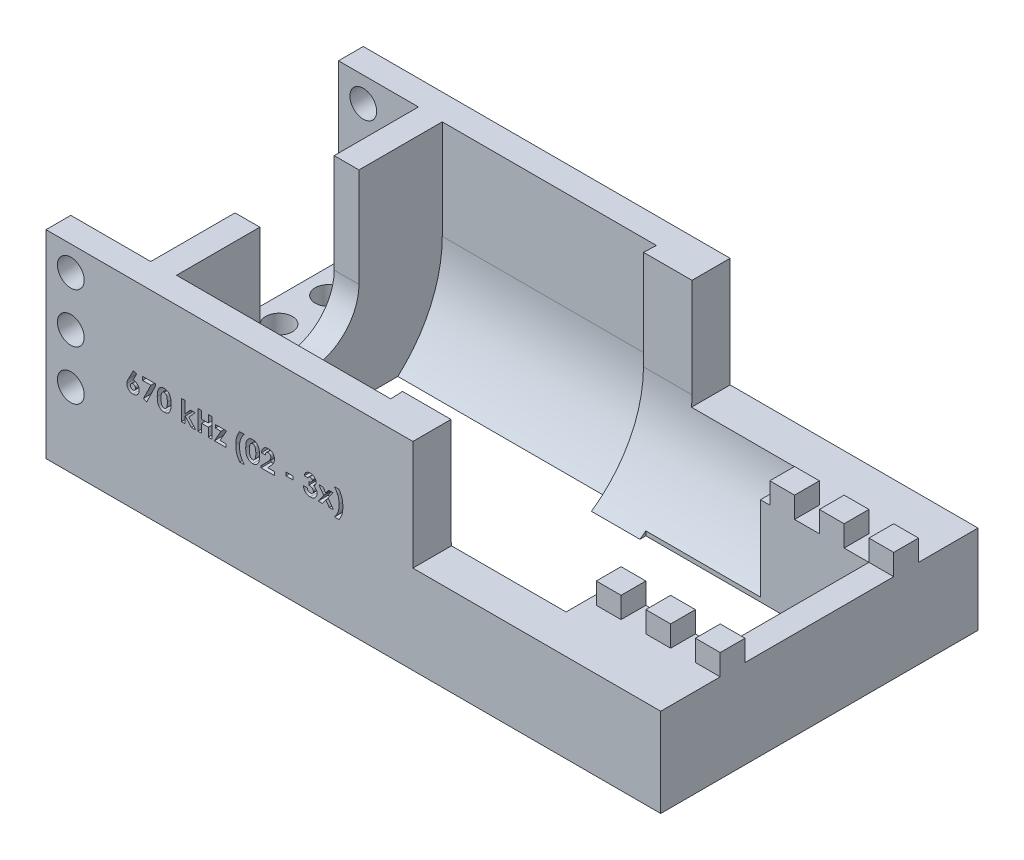
from build123d import *

# Parameters (mm, degrees)
SKETCH1_W                = 157.48
SKETCH1_H                = 50.8
BOSS_EXTRUDE1_DEPTH      = 40.64
SKETCH37_W               = 81.28
SKETCH37_H               = 25.4
CUT_EXTRUDE32_DEPTH      = 171.388379885
BOSS_EXTRUDE5_DEPTH      = 25.4
CUT_EXTRUDE54_DEPTH      = 105.109019782
CUT_EXTRUDE54_DEPTH_BACK = 105.109019782
SKETCH45_W               = 63.5
SKETCH45_H               = 28.09875
SKETCH97_W               = 20.4891
SKETCH97_H               = 81.28
CUT_EXTRUDE72_DEPTH      = 44.45
SKETCH98_R               = 3.429
CUT_EXTRUDE73_DEPTH      = 102.162495521
SKETCH99_W               = 57.15
SKETCH99_H               = 38.1
CUT_EXTRUDE74_DEPTH      = 105.109019782
SKETCH101_W              = 6.35
SKETCH101_H              = 6.35
BOSS_EXTRUDE7_DEPTH      = 5.3975
BOSS_EXTRUDE8_REACH      = 106.109
SKETCH102_W              = 20.4891
SKETCH102_H              = 6.35
SKETCH103_R              = 3.429
CUT_EXTRUDE75_DEPTH      = 126.672259469
CUT_EXTRUDE76_DEPTH      = 2.54


with BuildPart() as part:
    # Sketch1 → Boss-Extrude1 (new, symmetric)
    with BuildSketch(Plane.XY):
        with Locations((2.54, -25.4)):
            Rectangle(SKETCH1_W, SKETCH1_H)
    extrude(amount=BOSS_EXTRUDE1_DEPTH, both=True)

    # Sketch2 → Cut-Revolve1 (revolve, cut)
    with BuildSketch(Plane.XY, mode=Mode.PRIVATE) as cut_revolve1_sk:
        Polygon((-49.3609, 8.636), (-49.3609, -12.7), (-76.2, -12.7), (-76.2, -25.4), (19.629439755, -25.4), (72.533481331, -25.4), (72.533481331, -15.494), (47.133481331, -15.494), (47.133481331, 5.464285578), (5.358695608, 5.464285578), (5.5031, 8.636), align=None)
    revolve(cut_revolve1_sk.sketch.rotate(Axis((-607.361866059, -25.4, 0), (1, 0, 0)), 90), axis=Axis((-607.361866059, -25.4, 0), (1, 0, 0)), mode=Mode.SUBTRACT)

    # Sketch37 → Cut-Extrude32 (cut, through all)
    with BuildSketch(Plane(origin=(81.28, 0, 0), x_dir=(0, 0, -1), z_dir=(1, 0, 0))):
        with Locations((0, -12.7)):
            Rectangle(SKETCH37_W, SKETCH37_H)
    extrude(amount=-CUT_EXTRUDE32_DEPTH, mode=Mode.SUBTRACT)

    # Sketch39 → Boss-Extrude5 (add)
    with BuildSketch(Plane(origin=(0, -25.4, 0), x_dir=(1, 0, 0), z_dir=(0, 1, 0))):
        Polygon((-49.3609, -12.7), (-76.2, -12.7), (-76.2, -40.64), (81.28, -40.64), (81.28, 40.64), (-76.2, 40.64), (-76.2, 12.7), (-49.3609, 12.7), (-49.3609, 34.036), (5.5031, 34.036), (5.358695608, 30.864285578), (47.133481331, 30.864285578), (47.133481331, 9.906), (72.533481331, 9.906), (72.533481331, -9.906), (47.133481331, -9.906), (47.133481331, -30.864285578), (5.358695608, -30.864285578), (5.5031, -34.036), (-49.3609, -34.036), align=None)
    extrude(amount=BOSS_EXTRUDE5_DEPTH)

    # Sketch45 → Cut-Extrude54 (cut, two sides: drawn at the far end of the back side and taken through both)
    with BuildSketch(Plane.XY.offset(-CUT_EXTRUDE54_DEPTH_BACK)):
        with Locations((49.53, -14.049375)):
            Rectangle(SKETCH45_W, SKETCH45_H)
    extrude(amount=CUT_EXTRUDE54_DEPTH + CUT_EXTRUDE54_DEPTH_BACK, mode=Mode.SUBTRACT)

    # Sketch97 → Cut-Extrude72 (cut)
    with BuildSketch(Plane(origin=(0, 0, 0), x_dir=(1, 0, 0), z_dir=(0, 1, 0))):
        with Locations((-65.95545, 0)):
            Rectangle(SKETCH97_W, SKETCH97_H)
    extrude(amount=-CUT_EXTRUDE72_DEPTH, mode=Mode.SUBTRACT)

    # Sketch98 → Cut-Extrude73 (cut, through all)
    with BuildSketch(Plane(origin=(0, -44.45, 0), x_dir=(1, 0, 0), z_dir=(0, 1, 0))):
        with Locations(Location((-69.85, 25.4, 0), (0, 0, 270))):
            Circle(SKETCH98_R)
        with Locations(Location((-69.85, 12.7, 0), (0, 0, 270))):
            Circle(SKETCH98_R)
        with Locations(Location((-69.85, 0, 0), (0, 0, 270))):
            Circle(SKETCH98_R)
        with Locations(Location((-69.85, -12.7, 0), (0, 0, 270))):
            Circle(SKETCH98_R)
        with Locations(Location((-69.85, -25.4, 0), (0, 0, 270))):
            Circle(SKETCH98_R)
    extrude(amount=-CUT_EXTRUDE73_DEPTH, mode=Mode.SUBTRACT)

    # Sketch99 → Cut-Extrude74 (cut, through all)
    with BuildSketch(Plane(origin=(0, 0, 0), x_dir=(1, 0, 0), z_dir=(0, 1, 0))):
        with Locations((46.355, 0)):
            Rectangle(SKETCH99_W, SKETCH99_H)
    extrude(amount=-CUT_EXTRUDE74_DEPTH, mode=Mode.SUBTRACT)

    # Sketch101 → Boss-Extrude7 (add)
    with BuildSketch(Plane(origin=(0, -28.09875, 0), x_dir=(1, 0, 0), z_dir=(0, 1, 0))):
        with Locations((52.705, 22.225)):
            Rectangle(SKETCH101_W, SKETCH101_H)
        with Locations((65.405, 22.225)):
            Rectangle(SKETCH101_W, SKETCH101_H)
        with Locations((78.105, 22.225)):
            Rectangle(SKETCH101_W, SKETCH101_H)
        with Locations((78.105, -22.225)):
            Rectangle(SKETCH101_W, SKETCH101_H)
        with Locations((65.405, -22.225)):
            Rectangle(SKETCH101_W, SKETCH101_H)
        with Locations((52.705, -22.225)):
            Rectangle(SKETCH101_W, SKETCH101_H)
    extrude(amount=BOSS_EXTRUDE7_DEPTH)

    # Sketch102 → Boss-Extrude8 (add, up to next)
    with BuildSketch(Plane(origin=(0, 0, 0), x_dir=(1, 0, 0), z_dir=(0, 1, 0)), mode=Mode.PRIVATE) as boss_extrude8_sk1:
        with Locations((-65.95545, 37.465)):
            Rectangle(SKETCH102_W, SKETCH102_H)
    boss_extrude8_tool1 = extrude(boss_extrude8_sk1.sketch, amount=-BOSS_EXTRUDE8_REACH, mode=Mode.PRIVATE) - part.part
    # Sketch102 → Boss-Extrude8 (add, up to next)
    with BuildSketch(Plane(origin=(0, 0, 0), x_dir=(1, 0, 0), z_dir=(0, 1, 0)), mode=Mode.PRIVATE) as boss_extrude8_sk2:
        with Locations((-65.95545, -37.465)):
            Rectangle(SKETCH102_W, SKETCH102_H)
    boss_extrude8_tool2 = extrude(boss_extrude8_sk2.sketch, amount=-BOSS_EXTRUDE8_REACH, mode=Mode.PRIVATE) - part.part
    add(boss_extrude8_tool1.solids().sort_by_distance((-65.95545, 0, -37.465))[0])
    add(boss_extrude8_tool2.solids().sort_by_distance((-65.95545, 0, 37.465))[0])

    # Sketch103 → Cut-Extrude75 (cut, through all)
    with BuildSketch(Plane.XY.offset(40.64)):
        with Locations((-69.85, -6.35)):
            Circle(SKETCH103_R)
        with Locations((-69.85, -19.05)):
            Circle(SKETCH103_R)
        with Locations((-69.85, -31.75)):
            Circle(SKETCH103_R)
    extrude(amount=-CUT_EXTRUDE75_DEPTH, mode=Mode.SUBTRACT)

    # Sketch104 → Cut-Extrude76 (cut)
    # profile 1 of 13: a face of its own
    with BuildSketch(Plane.XY.offset(40.64)):
        with BuildLine():
            Line((-53.797841785, -20.030968002), (-52.981703964, -20.442089797))
            Line((-52.981703964, -20.442089797), (-53.867040503, -22.157810951))
            add(Edge.make_bspline(
                [(-53.867040503, -22.157810951), (-53.814368963, -22.159008106), (-53.710567955, -22.161367368), (-53.558413758, -22.185184077), (-53.41176591, -22.219925848), (-53.271763544, -22.271528946), (-53.137713629, -22.336910544), (-53.00992314, -22.416845793), (-52.888337675, -22.511046892), (-52.774152481, -22.618627316), (-52.669200502, -22.735917579), (-52.57764104, -22.862535194), (-52.500284919, -22.995854037), (-52.436658572, -23.136234839), (-52.387532764, -23.283579989), (-52.353677585, -23.437794908), (-52.330867365, -23.598769622), (-52.329224917, -23.708594399), (-52.328386657, -23.764645887)],
                knots=[0, 0, 0, 0, 1.018436016, 2.007055153, 2.973393371, 3.930660523, 4.887657592, 5.854775734, 6.842086597, 7.859062064, 8.886574234, 9.883115039, 10.877210128, 11.864259127, 12.860583739, 13.876541934, 14.916246501, 16, 16, 16, 16], degree=3))
            add(Edge.make_bspline(
                [(-52.328386657, -23.764645887), (-52.329631405, -23.818659555), (-52.33208508, -23.925132392), (-52.355196241, -24.081270011), (-52.392187401, -24.230656385), (-52.441697369, -24.374860684), (-52.508551703, -24.511691202), (-52.588012639, -24.642977063), (-52.682933792, -24.767069144), (-52.790495599, -24.883280834), (-52.907830611, -24.990216199), (-53.033315519, -25.082717685), (-53.164246753, -25.161935484), (-53.301358368, -25.226361871), (-53.444292079, -25.276301017), (-53.593225029, -25.312094569), (-53.748008122, -25.333898332), (-53.853401502, -25.336554922), (-53.906728003, -25.337899092)],
                knots=[0, 0, 0, 0, 1.04492794, 2.059783157, 3.047058374, 4.02090364, 5.004635914, 5.988762478, 6.986742238, 8.022866921, 9.05013389, 10.054679023, 11.035405115, 12.007566906, 12.981412172, 13.960752762, 14.96819022, 16, 16, 16, 16], degree=3))
            add(Edge.make_bspline(
                [(-53.906728003, -25.337899092), (-53.962436749, -25.336237006), (-54.072269543, -25.332960112), (-54.233090179, -25.310015623), (-54.38754573, -25.27382947), (-54.534022924, -25.220499039), (-54.673476576, -25.152919934), (-54.805729305, -25.070675296), (-54.931417604, -24.974066969), (-55.046718342, -24.862051982), (-55.153378998, -24.742770841), (-55.244432003, -24.615635281), (-55.324485163, -24.486357689), (-55.38707923, -24.350951492), (-55.437791857, -24.211933235), (-55.473346515, -24.068359311), (-55.494040778, -23.92027198), (-55.496867173, -23.820341062), (-55.498298516, -23.769734028)],
                knots=[0, 0, 0, 0, 1.07701802, 2.123399041, 3.135246409, 4.139496384, 5.131070391, 6.126736415, 7.14616676, 8.190015937, 9.230996512, 10.236017373, 11.210212812, 12.166803947, 13.115014964, 14.067955921, 15.02157389, 16, 16, 16, 16], degree=3))
            add(Edge.make_bspline(
                [(-55.498298516, -23.769734028), (-55.497130351, -23.730695245), (-55.494777605, -23.652069098), (-55.481568402, -23.534277736), (-55.458466658, -23.4164924), (-55.433245129, -23.317101349), (-55.406161067, -23.233266124), (-55.379510921, -23.162037797), (-55.346571685, -23.082931101), (-55.309331698, -22.995405827), (-55.265149724, -22.90058475), (-55.215063972, -22.798070535), (-55.160344999, -22.686854181), (-55.120896994, -22.610585473), (-55.100405887, -22.570968002)],
                knots=[0, 0, 0, 0, 1.101224057, 2.217922746, 3.338058447, 4.48432198, 5.107562151, 5.821941898, 6.628510777, 7.524171874, 8.504386177, 9.57834465, 10.742080967, 12, 12, 12, 12], degree=3))
            Line((-55.100405887, -22.570968002), (-53.797841785, -20.030968002))
        make_face()
        with BuildLine():
            add(Edge.make_bspline(
                [(-53.923010054, -23.067570567), (-53.966332107, -23.069877067), (-54.050802568, -23.074374341), (-54.172233, -23.110959704), (-54.280960528, -23.174224964), (-54.377186529, -23.258399817), (-54.456620687, -23.360993678), (-54.514578966, -23.478546317), (-54.550272409, -23.608576984), (-54.554041488, -23.699625965), (-54.555974798, -23.746328579)],
                knots=[0, 0, 0, 0, 1.002982451, 1.955641158, 2.906481193, 3.898338504, 4.901690695, 5.893267499, 6.91937378, 8, 8, 8, 8], degree=3))
            add(Edge.make_bspline(
                [(-54.555974798, -23.746328579), (-54.554178716, -23.793404872), (-54.550686021, -23.88495029), (-54.512979791, -24.0161367), (-54.453708945, -24.136130887), (-54.370957178, -24.240865078), (-54.273713405, -24.328663596), (-54.16389336, -24.391462534), (-54.046199791, -24.431922234), (-53.964378392, -24.43616875), (-53.923010054, -24.438315759)],
                knots=[0, 0, 0, 0, 1.082440894, 2.10493434, 3.118992292, 4.14970393, 5.163309616, 6.119560889, 7.049262895, 8, 8, 8, 8], degree=3))
            add(Edge.make_bspline(
                [(-53.923010054, -24.438315759), (-53.879692478, -24.435963668), (-53.794580097, -24.43134217), (-53.671629449, -24.394729894), (-53.559630232, -24.331613164), (-53.459533617, -24.24622667), (-53.375346045, -24.142298392), (-53.312867513, -24.022850336), (-53.275046364, -23.889700941), (-53.270842485, -23.796443803), (-53.268675118, -23.748363836)],
                knots=[0, 0, 0, 0, 0.9808065, 1.927134099, 2.877046816, 3.875297615, 4.892350953, 5.889653802, 6.911982738, 8, 8, 8, 8], degree=3))
            add(Edge.make_bspline(
                [(-53.268675118, -23.748363836), (-53.270505692, -23.701630484), (-53.274078001, -23.610431783), (-53.311298125, -23.480598814), (-53.369832732, -23.362193844), (-53.45317038, -23.260834045), (-53.55073034, -23.174292476), (-53.664363382, -23.112120275), (-53.790012183, -23.074061349), (-53.87796344, -23.069769006), (-53.923010054, -23.067570567)],
                knots=[0, 0, 0, 0, 1.061558498, 2.071598807, 3.049133314, 4.049112293, 5.04019254, 6.001201546, 6.976261317, 8, 8, 8, 8], degree=3))
        make_face(mode=Mode.SUBTRACT)
    # profile 2 of 13: a face of its own
    with BuildSketch(Plane.XY.offset(40.64)):
        Polygon((-51.443063677, -20.166515547), (-48.128648612, -20.171603688), (-48.129666241, -20.676347278), (-50.418312074, -25.347260739), (-51.232414638, -24.951403368), (-49.329449894, -21.073222278), (-51.445098933, -21.070169393), align=None)
    # profile 3 of 13: a face of its own
    with BuildSketch(Plane.XY.offset(40.64)):
        with BuildLine():
            add(Edge.make_bspline(
                [(-45.938726273, -20.051726553), (-45.893234343, -20.052378227), (-45.803745721, -20.053660155), (-45.672228969, -20.067643549), (-45.545539231, -20.088362395), (-45.423940937, -20.119456268), (-45.306810685, -20.157840392), (-45.194566649, -20.204867496), (-45.087014663, -20.259738442), (-44.985298057, -20.324361806), (-44.887637093, -20.396699831), (-44.796464751, -20.479275394), (-44.71083779, -20.570486018), (-44.629569647, -20.66941826), (-44.555877931, -20.778549509), (-44.487461305, -20.896306544), (-44.424294402, -21.022614496), (-44.367004762, -21.158856686), (-44.316131785, -21.306385074), (-44.271005673, -21.466224413), (-44.235286712, -21.640186535), (-44.204439635, -21.827519675), (-44.181927499, -22.028986415), (-44.164068673, -22.243752467), (-44.15559614, -22.472255226), (-44.154414771, -22.629034709), (-44.153806402, -22.709771425)],
                knots=[0, 0, 0, 0, 0.901130509, 1.772642458, 2.618021634, 3.442950296, 4.257072769, 5.058526022, 5.852189604, 6.646649808, 7.443863585, 8.257764029, 9.080389029, 9.921293497, 10.791975532, 11.686614496, 12.618507777, 13.588530692, 14.613168019, 15.709161122, 16.877218554, 18.130372376, 19.470250102, 20.89315856, 22.400070136, 24, 24, 24, 24], degree=3))
            add(Edge.make_bspline(
                [(-44.153806402, -22.709771425), (-44.154717543, -22.79119143), (-44.15649119, -22.949685175), (-44.1664596, -23.180497386), (-44.18349049, -23.397428648), (-44.207754147, -23.600482384), (-44.238953906, -23.789703841), (-44.277289335, -23.965103839), (-44.323004123, -24.126142939), (-44.375099885, -24.273977438), (-44.433611965, -24.40994155), (-44.496400383, -24.536054287), (-44.564082309, -24.652924713), (-44.635618609, -24.761040365), (-44.713913365, -24.858809702), (-44.794659834, -24.949100208), (-44.881890552, -25.028759514), (-44.973712546, -25.09941035), (-45.071246058, -25.16086676), (-45.174433486, -25.213932835), (-45.283745907, -25.258766499), (-45.399144828, -25.295368382), (-45.52093553, -25.323955123), (-45.648851131, -25.343864738), (-45.782776815, -25.356462176), (-45.873908457, -25.357915881), (-45.920408966, -25.358657643)],
                knots=[0, 0, 0, 0, 1.620658582, 3.154805097, 4.597513041, 5.950858699, 7.224017385, 8.41333232, 9.522541302, 10.553977799, 11.530962086, 12.467006968, 13.356402105, 14.217806659, 15.044510143, 15.847492689, 16.626412399, 17.392110113, 18.150750003, 18.9177564, 19.698896924, 20.499633838, 21.325040445, 22.186418537, 23.07460834, 24, 24, 24, 24], degree=3))
            add(Edge.make_bspline(
                [(-45.920408966, -25.358657643), (-45.966921929, -25.358031154), (-46.058447933, -25.356798379), (-46.192563129, -25.342485417), (-46.321400439, -25.323299242), (-46.44379692, -25.292756882), (-46.561381381, -25.25709927), (-46.672669897, -25.210526087), (-46.778772788, -25.156921887), (-46.878926703, -25.094203493), (-46.974139055, -25.024136031), (-47.063043106, -24.9440376), (-47.146016674, -24.855278648), (-47.22517803, -24.759181914), (-47.298438873, -24.653909719), (-47.366347733, -24.539781581), (-47.429534862, -24.417593858), (-47.487295253, -24.285950475), (-47.537957163, -24.142711489), (-47.583056923, -23.986190431), (-47.620124088, -23.815125011), (-47.650419578, -23.629990145), (-47.673393105, -23.430610823), (-47.690624622, -23.217481125), (-47.700883099, -22.989720884), (-47.701801845, -22.833254437), (-47.702275953, -22.75251181)],
                knots=[0, 0, 0, 0, 0.932206437, 1.834351651, 2.702073111, 3.54175199, 4.361357295, 5.163418684, 5.957335048, 6.742462398, 7.530089927, 8.324821639, 9.137967011, 9.964429646, 10.819179067, 11.706850148, 12.625534945, 13.575803601, 14.586923447, 15.669734413, 16.839775183, 18.09435756, 19.42984934, 20.862842702, 22.381107713, 24, 24, 24, 24], degree=3))
            add(Edge.make_bspline(
                [(-47.702275953, -22.75251181), (-47.701076788, -22.640529121), (-47.698763304, -22.42448711), (-47.676419641, -22.112486936), (-47.64432249, -21.823821492), (-47.596658472, -21.559012666), (-47.536454942, -21.317853566), (-47.46197222, -21.101034862), (-47.376406279, -20.90659875), (-47.303724327, -20.791803598), (-47.268766337, -20.736590335)],
                knots=[0, 0, 0, 0, 1.285763078, 2.48055164, 3.590412408, 4.619624867, 5.568178791, 6.44158591, 7.250446348, 8, 8, 8, 8], degree=3))
            add(Edge.make_bspline(
                [(-47.268766337, -20.736590335), (-47.228347372, -20.681904845), (-47.14910295, -20.57468983), (-47.010040821, -20.43509408), (-46.861006149, -20.315062264), (-46.698295132, -20.219410581), (-46.525485749, -20.142781946), (-46.34004684, -20.090694636), (-46.143513907, -20.056582405), (-46.008074945, -20.053370924), (-45.938726273, -20.051726553)],
                knots=[0, 0, 0, 0, 1.044484395, 2.047790199, 3.020498258, 3.979514647, 4.941887394, 5.919228087, 6.934584507, 8, 8, 8, 8], degree=3))
        make_face()
        with BuildLine():
            add(Edge.make_bspline(
                [(-45.916338453, -20.965556681), (-45.956202191, -20.967566739), (-46.034270405, -20.971503187), (-46.148185556, -21.001221879), (-46.254573963, -21.050516722), (-46.336727402, -21.107609224), (-46.396960382, -21.163768534), (-46.440285143, -21.213510851), (-46.480683121, -21.269980393), (-46.517274014, -21.334619062), (-46.553009937, -21.404814845), (-46.584320927, -21.483429849), (-46.613651722, -21.568285093), (-46.640408285, -21.660948339), (-46.663824285, -21.762509133), (-46.683940876, -21.874603822), (-46.701075474, -21.997844469), (-46.715093023, -22.131920666), (-46.726267888, -22.27715636), (-46.734159677, -22.433246811), (-46.73932998, -22.600512037), (-46.740179065, -22.715533986), (-46.740617299, -22.77489963)],
                knots=[0, 0, 0, 0, 1.080082074, 2.115207483, 3.16876267, 4.24554989, 4.811727479, 5.398379869, 6.031368951, 6.690803856, 7.410656193, 8.165615678, 8.982990849, 9.8446563, 10.779503287, 11.807863768, 12.931744631, 14.152681826, 15.462701681, 16.881093761, 18.390256125, 20, 20, 20, 20], degree=3))
            add(Edge.make_bspline(
                [(-46.740617299, -22.77489963), (-46.740289726, -22.851579813), (-46.739660277, -22.998925301), (-46.72775314, -23.210687614), (-46.711319149, -23.404309178), (-46.687218812, -23.579308432), (-46.656340469, -23.736301264), (-46.61684813, -23.874383046), (-46.571755556, -23.994869962), (-46.518431316, -24.09725681), (-46.458126797, -24.183488119), (-46.395134739, -24.258902756), (-46.326559959, -24.322251998), (-46.254339333, -24.374644576), (-46.177638589, -24.415252512), (-46.096378746, -24.443803031), (-46.010718117, -24.461507814), (-45.952038951, -24.463948914), (-45.922444222, -24.465180079)],
                knots=[0, 0, 0, 0, 1.763680567, 3.389016106, 4.877548503, 6.232703277, 7.450853911, 8.554863194, 9.533038298, 10.405638038, 11.202177122, 11.949535534, 12.661853539, 13.343998613, 13.996721991, 14.650750072, 15.319508288, 16, 16, 16, 16], degree=3))
            add(Edge.make_bspline(
                [(-45.922444222, -24.465180079), (-45.893855077, -24.464366194), (-45.837881085, -24.462772709), (-45.756566798, -24.44537897), (-45.678898524, -24.4194673), (-45.607078023, -24.379815673), (-45.538156902, -24.331659006), (-45.475708646, -24.270587387), (-45.415654129, -24.200375406), (-45.382090849, -24.146808321), (-45.364783966, -24.119186489)],
                knots=[0, 0, 0, 0, 0.993822058, 1.945780014, 2.883268784, 3.834347197, 4.791273957, 5.802073761, 6.866640809, 8, 8, 8, 8], degree=3))
            add(Edge.make_bspline(
                [(-45.364783966, -24.119186489), (-45.344185324, -24.081970148), (-45.300831588, -24.003641323), (-45.251824602, -23.870946882), (-45.207807366, -23.722162847), (-45.172741936, -23.555370133), (-45.145632905, -23.371164076), (-45.127088735, -23.16936001), (-45.114415278, -22.950092454), (-45.113097217, -22.797985714), (-45.112412171, -22.718930079)],
                knots=[0, 0, 0, 0, 0.709178075, 1.49259933, 2.354444379, 3.2984804, 4.334744881, 5.461082589, 6.680428437, 8, 8, 8, 8], degree=3))
            add(Edge.make_bspline(
                [(-45.112412171, -22.718930079), (-45.1128728, -22.639204673), (-45.113757236, -22.486127232), (-45.123888934, -22.266151329), (-45.140875623, -22.065140721), (-45.164552778, -21.883291355), (-45.196128783, -21.720906654), (-45.232949229, -21.577249106), (-45.277851795, -21.45273253), (-45.331715757, -21.347155754), (-45.390747374, -21.257510453), (-45.452544595, -21.179636704), (-45.518971156, -21.113252216), (-45.590860817, -21.06054269), (-45.665804977, -21.017267613), (-45.74583841, -20.98846093), (-45.829568907, -20.968736152), (-45.887049119, -20.966629922), (-45.916338453, -20.965556681)],
                knots=[0, 0, 0, 0, 1.793252462, 3.443149575, 4.951893238, 6.329928069, 7.565979818, 8.670890183, 9.663085447, 10.536672933, 11.330291238, 12.073877585, 12.769904364, 13.435268276, 14.074115772, 14.709078271, 15.342204288, 16, 16, 16, 16], degree=3))
        make_face(mode=Mode.SUBTRACT)
    # profile 4 of 13: a face of its own
    with BuildSketch(Plane.XY.offset(40.64)):
        Polygon((-41.484587846, -20.065175134), (-40.547352269, -20.066192762), (-40.55244041, -23.050896288), (-39.169483679, -21.512242442), (-37.99514073, -21.514277698), (-39.606046179, -23.304285711), (-37.805861884, -25.251008467), (-38.970028551, -25.248973211), (-40.553458038, -23.525111031), (-40.556510923, -25.245920326), (-41.4937465, -25.244902698), align=None)
    # profile 5 of 13: a face of its own
    with BuildSketch(Plane.XY.offset(40.64)):
        Polygon((-37.288920759, -20.203098239), (-36.314032938, -20.205133495), (-36.318103451, -22.111151124), (-34.627823003, -22.114204008), (-34.62375249, -20.20818638), (-33.651917554, -20.209204008), (-33.661076208, -25.261728047), (-34.632911144, -25.260710419), (-34.628840631, -23.045333816), (-36.319121079, -23.042280931), (-36.323191592, -25.257657534), (-37.298079413, -25.255622278), align=None)
    # profile 6 of 13: a face of its own
    with BuildSketch(Plane.XY.offset(40.64)):
        Polygon((-32.799161343, -21.531312608), (-29.931485061, -21.535383121), (-31.618712625, -24.476328634), (-30.032230254, -24.47836389), (-30.033247882, -25.27211389), (-33.062727049, -25.267025749), (-31.367358459, -22.327097865), (-32.800178972, -22.325062608), align=None)
    # profile 7 of 13: a face of its own
    with BuildSketch(Plane.XY.offset(40.64)):
        with BuildLine():
            Line((-26.592664702, -20.007288555), (-25.405092586, -20.009323811))
            add(Edge.make_bspline(
                [(-25.405092586, -20.009323811), (-25.454821166, -20.066880776), (-25.553708683, -20.18133539), (-25.69149151, -20.359843393), (-25.821401991, -20.540847091), (-25.940627027, -20.726291918), (-26.049270998, -20.915832146), (-26.14941587, -21.108523818), (-26.240015853, -21.304695216), (-26.320822026, -21.505412657), (-26.39254204, -21.711344913), (-26.453262339, -21.924533473), (-26.505035207, -22.144266054), (-26.548069298, -22.371386654), (-26.581164649, -22.605730792), (-26.605846595, -22.847394943), (-26.620065694, -23.095957192), (-26.622141644, -23.264020368), (-26.623193548, -23.349179581)],
                knots=[0, 0, 0, 0, 1.002489981, 1.993496421, 2.971219517, 3.938664138, 4.898140138, 5.850084977, 6.800400717, 7.745304635, 8.70122119, 9.673489664, 10.665867043, 11.676124915, 12.719503261, 13.784643219, 14.87745761, 16, 16, 16, 16], degree=3))
            add(Edge.make_bspline(
                [(-26.623193548, -23.349179581), (-26.622248268, -23.441465944), (-26.620387655, -23.623114995), (-26.604735303, -23.891314783), (-26.579439497, -24.151031349), (-26.544364504, -24.402458588), (-26.497246956, -24.645187068), (-26.440233853, -24.879497675), (-26.373765137, -25.106004216), (-26.320067124, -25.25207726), (-26.293482009, -25.324395927)],
                knots=[0, 0, 0, 0, 1.099739308, 2.164638362, 3.200411981, 4.20887816, 5.188793088, 6.145725013, 7.081975087, 8, 8, 8, 8], degree=3))
            add(Edge.make_bspline(
                [(-26.293482009, -25.324395927), (-26.270737666, -25.379983432), (-26.224258902, -25.493578206), (-26.140305264, -25.6620367), (-26.048288576, -25.835329732), (-25.94375569, -26.011481522), (-25.828947393, -26.191525293), (-25.702474524, -26.374657027), (-25.564884927, -26.561208288), (-25.467187202, -26.684901686), (-25.417304125, -26.748057786)],
                knots=[0, 0, 0, 0, 0.858929816, 1.755249428, 2.690952412, 3.665510533, 4.684540435, 5.745215536, 6.848738937, 8, 8, 8, 8], degree=3))
            Line((-25.417304125, -26.748057786), (-26.60487624, -26.746022529))
            add(Edge.make_bspline(
                [(-26.60487624, -26.746022529), (-26.648995352, -26.67398762), (-26.735966734, -26.53198622), (-26.858021615, -26.318840621), (-26.968968943, -26.108906425), (-27.070052272, -25.903048804), (-27.16118616, -25.700742677), (-27.239879564, -25.500927764), (-27.310998447, -25.305937305), (-27.370455095, -25.111848145), (-27.422215105, -24.915378618), (-27.465029995, -24.712099498), (-27.503781989, -24.500907356), (-27.531737592, -24.280948403), (-27.557496031, -24.05279146), (-27.572471137, -23.816085022), (-27.58352616, -23.571128539), (-27.584404913, -23.405163058), (-27.584852202, -23.320685991)],
                knots=[0, 0, 0, 0, 1.120159379, 2.208154347, 3.256529794, 4.268448603, 5.249058582, 6.197977182, 7.11573074, 8.000743067, 8.88887082, 9.809090456, 10.754997591, 11.735349601, 12.748737081, 13.799310544, 14.879840621, 16, 16, 16, 16], degree=3))
            add(Edge.make_bspline(
                [(-27.584852202, -23.320685991), (-27.584014147, -23.237906349), (-27.582361314, -23.074646146), (-27.570992618, -22.834020223), (-27.552718345, -22.600858603), (-27.527481823, -22.375805779), (-27.495264744, -22.158081509), (-27.454116926, -21.948832698), (-27.40770894, -21.747019281), (-27.35357946, -21.551585099), (-27.289190477, -21.360293628), (-27.218748771, -21.168586663), (-27.136331946, -20.976953653), (-27.046041544, -20.784192991), (-26.947239698, -20.590033096), (-26.838226096, -20.396091591), (-26.719827429, -20.201110709), (-26.635454075, -20.072508361), (-26.592664702, -20.007288555)],
                knots=[0, 0, 0, 0, 1.129592879, 2.227812996, 3.286476223, 4.320577809, 5.317588922, 6.2889433, 7.229865958, 8.14292488, 9.054856714, 9.983447437, 10.929185354, 11.900374281, 12.887840885, 13.901232916, 14.935624538, 16, 16, 16, 16], degree=3))
        make_face()
    # profile 8 of 13: a face of its own
    with BuildSketch(Plane.XY.offset(40.64)):
        with BuildLine():
            add(Edge.make_bspline(
                [(-23.274188238, -20.110939469), (-23.228696307, -20.111591143), (-23.139207685, -20.112873071), (-23.007690934, -20.126856465), (-22.881001195, -20.147575311), (-22.759402901, -20.178669184), (-22.642272649, -20.217053308), (-22.530028613, -20.264080411), (-22.422476628, -20.318951357), (-22.320760022, -20.383574721), (-22.223099058, -20.455912746), (-22.131926715, -20.538488309), (-22.046299755, -20.629698933), (-21.965031612, -20.728631175), (-21.891339895, -20.837762425), (-21.822923269, -20.95551946), (-21.759756367, -21.081827411), (-21.702466726, -21.218069602), (-21.651593749, -21.36559799), (-21.606467637, -21.525437328), (-21.570748676, -21.69939945), (-21.5399016, -21.88673259), (-21.517389464, -22.08819933), (-21.499530637, -22.302965382), (-21.491058105, -22.531468141), (-21.489876736, -22.688247624), (-21.489268366, -22.76898434)],
                knots=[0, 0, 0, 0, 0.901130509, 1.772642458, 2.618021634, 3.442950296, 4.257072769, 5.058526022, 5.852189604, 6.646649808, 7.443863585, 8.257764029, 9.080389029, 9.921293497, 10.791975532, 11.686614496, 12.618507777, 13.588530692, 14.613168019, 15.709161122, 16.877218554, 18.130372376, 19.470250102, 20.89315856, 22.400070136, 24, 24, 24, 24], degree=3))
            add(Edge.make_bspline(
                [(-21.489268366, -22.76898434), (-21.490179508, -22.850404346), (-21.491953154, -23.008898091), (-21.501921565, -23.239710301), (-21.518952455, -23.456641564), (-21.543216111, -23.6596953), (-21.574415871, -23.848916757), (-21.6127513, -24.024316755), (-21.658466087, -24.185355854), (-21.710561849, -24.333190354), (-21.769073929, -24.469154466), (-21.831862348, -24.595267202), (-21.899544273, -24.712137629), (-21.971080573, -24.82025328), (-22.049375329, -24.918022618), (-22.130121799, -25.008313123), (-22.217352517, -25.08797243), (-22.30917451, -25.158623265), (-22.406708023, -25.220079676), (-22.509895451, -25.27314575), (-22.619207871, -25.317979414), (-22.734606793, -25.354581298), (-22.856397495, -25.383168039), (-22.984313096, -25.403077653), (-23.11823878, -25.415675091), (-23.209370421, -25.417128796), (-23.25587093, -25.417870558)],
                knots=[0, 0, 0, 0, 1.620658582, 3.154805097, 4.597513041, 5.950858699, 7.224017385, 8.41333232, 9.522541302, 10.553977799, 11.530962086, 12.467006968, 13.356402105, 14.217806659, 15.044510143, 15.847492689, 16.626412399, 17.392110113, 18.150750003, 18.9177564, 19.698896924, 20.499633838, 21.325040445, 22.186418537, 23.07460834, 24, 24, 24, 24], degree=3))
            add(Edge.make_bspline(
                [(-23.25587093, -25.417870558), (-23.302383893, -25.417244069), (-23.393909897, -25.416011294), (-23.528025094, -25.401698333), (-23.656862404, -25.382512157), (-23.779258884, -25.351969797), (-23.896843346, -25.316312185), (-24.008131862, -25.269739002), (-24.114234752, -25.216134802), (-24.214388667, -25.153416408), (-24.30960102, -25.083348947), (-24.39850507, -25.003250515), (-24.481478638, -24.914491563), (-24.560639995, -24.818394829), (-24.633900838, -24.713122635), (-24.701809698, -24.598994497), (-24.764996827, -24.476806773), (-24.822757218, -24.345163391), (-24.873419128, -24.201924405), (-24.918518888, -24.045403346), (-24.955586052, -23.874337927), (-24.985881543, -23.689203061), (-25.008855069, -23.489823739), (-25.026086586, -23.27669404), (-25.036345064, -23.048933799), (-25.03726381, -22.892467353), (-25.037737917, -22.811724725)],
                knots=[0, 0, 0, 0, 0.932206437, 1.834351651, 2.702073111, 3.54175199, 4.361357295, 5.163418684, 5.957335048, 6.742462398, 7.530089927, 8.324821639, 9.137967011, 9.964429646, 10.819179067, 11.706850148, 12.625534945, 13.575803601, 14.586923447, 15.669734413, 16.839775183, 18.09435756, 19.42984934, 20.862842702, 22.381107713, 24, 24, 24, 24], degree=3))
            add(Edge.make_bspline(
                [(-25.037737917, -22.811724725), (-25.036538752, -22.699742037), (-25.034225269, -22.483700025), (-25.011881605, -22.171699852), (-24.979784455, -21.883034408), (-24.932120437, -21.618225582), (-24.871916907, -21.377066482), (-24.797434185, -21.160247778), (-24.711868244, -20.965811666), (-24.639186291, -20.851016513), (-24.604228302, -20.795803251)],
                knots=[0, 0, 0, 0, 1.285763078, 2.48055164, 3.590412408, 4.619624867, 5.568178791, 6.44158591, 7.250446348, 8, 8, 8, 8], degree=3))
            add(Edge.make_bspline(
                [(-24.604228302, -20.795803251), (-24.563809336, -20.741117761), (-24.484564914, -20.633902746), (-24.345502785, -20.494306995), (-24.196468113, -20.37427518), (-24.033757096, -20.278623496), (-23.860947713, -20.201994861), (-23.675508805, -20.149907551), (-23.478975872, -20.11579532), (-23.34353691, -20.11258384), (-23.274188238, -20.110939469)],
                knots=[0, 0, 0, 0, 1.044484395, 2.047790199, 3.020498258, 3.979514647, 4.941887394, 5.919228087, 6.934584507, 8, 8, 8, 8], degree=3))
        make_face()
        with BuildLine():
            add(Edge.make_bspline(
                [(-23.251800417, -21.024769597), (-23.291664156, -21.026779654), (-23.36973237, -21.030716103), (-23.48364752, -21.060434795), (-23.590035928, -21.109729638), (-23.672189366, -21.16682214), (-23.732422346, -21.222981449), (-23.775747108, -21.272723767), (-23.816145086, -21.329193309), (-23.852735979, -21.393831978), (-23.888471901, -21.464027761), (-23.919782892, -21.542642764), (-23.949113686, -21.627498009), (-23.975870249, -21.720161254), (-23.999286249, -21.821722049), (-24.01940284, -21.933816737), (-24.036537439, -22.057057385), (-24.050554987, -22.191133582), (-24.061729853, -22.336369276), (-24.069621641, -22.492459726), (-24.074791944, -22.659724952), (-24.07564103, -22.774746901), (-24.076079263, -22.834112546)],
                knots=[0, 0, 0, 0, 1.080082074, 2.115207483, 3.16876267, 4.24554989, 4.811727479, 5.398379869, 6.031368951, 6.690803856, 7.410656193, 8.165615678, 8.982990849, 9.8446563, 10.779503287, 11.807863768, 12.931744631, 14.152681826, 15.462701681, 16.881093761, 18.390256125, 20, 20, 20, 20], degree=3))
            add(Edge.make_bspline(
                [(-24.076079263, -22.834112546), (-24.075751691, -22.910792728), (-24.075122241, -23.058138216), (-24.063215105, -23.26990053), (-24.046781114, -23.463522093), (-24.022680777, -23.638521348), (-23.991802433, -23.795514179), (-23.952310095, -23.933595961), (-23.90721752, -24.054082877), (-23.853893281, -24.156469725), (-23.793588762, -24.242701035), (-23.730596703, -24.318115671), (-23.662021924, -24.381464914), (-23.589801298, -24.433857491), (-23.513100554, -24.474465428), (-23.43184071, -24.503015947), (-23.346180081, -24.520720729), (-23.287500916, -24.52316183), (-23.257906187, -24.524392994)],
                knots=[0, 0, 0, 0, 1.763680567, 3.389016106, 4.877548503, 6.232703277, 7.450853911, 8.554863194, 9.533038298, 10.405638038, 11.202177122, 11.949535534, 12.661853539, 13.343998613, 13.996721991, 14.650750072, 15.319508288, 16, 16, 16, 16], degree=3))
            add(Edge.make_bspline(
                [(-23.257906187, -24.524392994), (-23.229317041, -24.523579109), (-23.173343049, -24.521985624), (-23.092028762, -24.504591886), (-23.014360489, -24.478680215), (-22.942539988, -24.439028588), (-22.873618867, -24.390871922), (-22.811170611, -24.329800303), (-22.751116094, -24.259588321), (-22.717552813, -24.206021236), (-22.70024593, -24.178399405)],
                knots=[0, 0, 0, 0, 0.993822058, 1.945780014, 2.883268784, 3.834347197, 4.791273957, 5.802073761, 6.866640809, 8, 8, 8, 8], degree=3))
            add(Edge.make_bspline(
                [(-22.70024593, -24.178399405), (-22.679647288, -24.141183064), (-22.636293552, -24.062854239), (-22.587286566, -23.930159798), (-22.543269331, -23.781375763), (-22.5082039, -23.614583048), (-22.48109487, -23.430376992), (-22.4625507, -23.228572925), (-22.449877243, -23.00930537), (-22.448559181, -22.85719863), (-22.447874135, -22.778142994)],
                knots=[0, 0, 0, 0, 0.709178075, 1.49259933, 2.354444379, 3.2984804, 4.334744881, 5.461082589, 6.680428437, 8, 8, 8, 8], degree=3))
            add(Edge.make_bspline(
                [(-22.447874135, -22.778142994), (-22.448334765, -22.698417588), (-22.4492192, -22.545340147), (-22.459350899, -22.325364245), (-22.476337588, -22.124353636), (-22.500014743, -21.942504271), (-22.531590748, -21.780119569), (-22.568411194, -21.636462021), (-22.613313759, -21.511945445), (-22.667177722, -21.40636867), (-22.726209339, -21.316723369), (-22.788006559, -21.23884962), (-22.854433121, -21.172465131), (-22.926322782, -21.119755606), (-23.001266942, -21.076480528), (-23.081300375, -21.047673845), (-23.165030872, -21.027949067), (-23.222511084, -21.025842837), (-23.251800417, -21.024769597)],
                knots=[0, 0, 0, 0, 1.793252462, 3.443149575, 4.951893238, 6.329928069, 7.565979818, 8.670890183, 9.663085447, 10.536672933, 11.330291238, 12.073877585, 12.769904364, 13.435268276, 14.074115772, 14.709078271, 15.342204288, 16, 16, 16, 16], degree=3))
        make_face(mode=Mode.SUBTRACT)
    # profile 9 of 13: a face of its own
    with BuildSketch(Plane.XY.offset(40.64)):
        with BuildLine():
            Line((-20.032038335, -21.87570977), (-20.969273912, -21.873674513))
            add(Edge.make_bspline(
                [(-20.969273912, -21.873674513), (-20.964958672, -21.807411881), (-20.9565099, -21.677676805), (-20.925388611, -21.489537322), (-20.881911858, -21.311624113), (-20.823812751, -21.145255191), (-20.753706392, -20.9884375), (-20.667664017, -20.843880199), (-20.568643067, -20.709704399), (-20.456385191, -20.587646416), (-20.33345158, -20.477730215), (-20.200937242, -20.381622847), (-20.059442551, -20.301013148), (-19.910337381, -20.234252799), (-19.752536627, -20.183632489), (-19.586728682, -20.146700572), (-19.41218833, -20.125298198), (-19.292959413, -20.12266236), (-19.232182565, -20.121318744)],
                knots=[0, 0, 0, 0, 1.153716975, 2.258853192, 3.310018274, 4.333818661, 5.318140609, 6.291003652, 7.252180768, 8.212090915, 9.168462795, 10.11443455, 11.052081023, 11.99446218, 12.949214802, 13.927779655, 14.943687294, 16, 16, 16, 16], degree=3))
            add(Edge.make_bspline(
                [(-19.232182565, -20.121318744), (-19.157713075, -20.123412926), (-19.012180327, -20.127505503), (-18.801103058, -20.16684871), (-18.602929181, -20.227073967), (-18.41971332, -20.313483439), (-18.251756324, -20.42166381), (-18.100443403, -20.552280163), (-17.967662552, -20.70507787), (-17.855130654, -20.876461372), (-17.762863791, -21.057853959), (-17.697751033, -21.244842284), (-17.655061177, -21.432802696), (-17.650849292, -21.559342653), (-17.648753078, -21.622320347)],
                knots=[0, 0, 0, 0, 1.102847178, 2.155250157, 3.171524453, 4.165766084, 5.147661016, 6.124470049, 7.118762538, 8.138216347, 9.156888619, 10.12697054, 11.067811642, 12, 12, 12, 12], degree=3))
            add(Edge.make_bspline(
                [(-17.648753078, -21.622320347), (-17.649547365, -21.660342894), (-17.651147022, -21.7369186), (-17.663995998, -21.852854696), (-17.684704272, -21.970610061), (-17.71161472, -22.091234871), (-17.74925067, -22.213064028), (-17.792368514, -22.337876911), (-17.846255141, -22.463564566), (-17.906042903, -22.593395921), (-17.978390947, -22.726205451), (-18.061810627, -22.865257847), (-18.159896886, -23.008933919), (-18.270445989, -23.159368326), (-18.394264594, -23.315575597), (-18.532307168, -23.476970098), (-18.681748219, -23.645728407), (-18.788465202, -23.757646164), (-18.843448591, -23.815309129)],
                knots=[0, 0, 0, 0, 0.713299631, 1.436553483, 2.185750633, 2.956193528, 3.753585161, 4.576896478, 5.432704578, 6.318220154, 7.257955206, 8.268719102, 9.359664653, 10.520640433, 11.771103392, 13.098656053, 14.505151495, 16, 16, 16, 16], degree=3))
            Line((-18.843448591, -23.815309129), (-19.411285129, -24.411639257))
            Line((-19.411285129, -24.411639257), (-17.611100835, -24.414692142))
            Line((-17.611100835, -24.414692142), (-17.613136091, -25.304099193))
            Line((-17.613136091, -25.304099193), (-21.112759488, -25.297993424))
            Line((-21.112759488, -25.297993424), (-21.11174186, -24.838025475))
            Line((-21.11174186, -24.838025475), (-19.546629681, -23.24747259))
            add(Edge.make_bspline(
                [(-19.546629681, -23.24747259), (-19.501296615, -23.201209461), (-19.413462582, -23.111573406), (-19.29000496, -22.978559829), (-19.17716496, -22.853147483), (-19.077023239, -22.734472598), (-18.987444035, -22.623572007), (-18.911407133, -22.518501536), (-18.845614728, -22.421295277), (-18.7766513, -22.302757801), (-18.708602999, -22.162818399), (-18.648470913, -22.000858352), (-18.611490158, -21.846154302), (-18.605958379, -21.745291184), (-18.603288335, -21.696607206)],
                knots=[0, 0, 0, 0, 1.254997994, 2.431592319, 3.516174481, 4.523542409, 5.44019847, 6.277649425, 7.035996936, 7.713499715, 8.933447448, 10.045873176, 11.05679429, 12, 12, 12, 12], degree=3))
            add(Edge.make_bspline(
                [(-18.603288335, -21.696607206), (-18.605020123, -21.649856621), (-18.60839096, -21.558859012), (-18.646837368, -21.429471719), (-18.707755258, -21.312099571), (-18.793911125, -21.211301206), (-18.897591783, -21.126862578), (-19.018105091, -21.066389002), (-19.152529156, -21.028016848), (-19.247174136, -21.024002881), (-19.296293142, -21.021919706)],
                knots=[0, 0, 0, 0, 1.03324008, 2.011148709, 2.96281412, 3.944616, 4.928487981, 5.906858841, 6.913698166, 8, 8, 8, 8], degree=3))
            add(Edge.make_bspline(
                [(-19.296293142, -21.021919706), (-19.32141476, -21.022893694), (-19.371177685, -21.024823048), (-19.44443523, -21.03434319), (-19.513992852, -21.05353938), (-19.580985542, -21.077489998), (-19.644082148, -21.110298177), (-19.703629385, -21.150860132), (-19.760778959, -21.197273536), (-19.813358904, -21.251711075), (-19.862446963, -21.310929538), (-19.903962029, -21.377129677), (-19.940973282, -21.447323661), (-19.971401625, -21.523067149), (-19.995928873, -21.603772621), (-20.01377647, -21.689996602), (-20.02770117, -21.780997752), (-20.030575754, -21.843770936), (-20.032038335, -21.87570977)],
                knots=[0, 0, 0, 0, 0.959207522, 1.900075561, 2.810538258, 3.707374529, 4.610446985, 5.515094919, 6.453109674, 7.414149328, 8.39861141, 9.382392556, 10.389732599, 11.42325874, 12.491929578, 13.603854572, 14.780847375, 16, 16, 16, 16], degree=3))
        make_face()
    # profile 10 of 13: a face of its own
    with BuildSketch(Plane.XY.offset(40.64)):
        Polygon((-14.729197984, -23.016690402), (-12.983965612, -23.019743286), (-12.986000869, -23.891850658), (-14.73123324, -23.888797773), align=None)
    # profile 11 of 13: a face of its own
    with BuildSketch(Plane.XY.offset(40.64)):
        with BuildLine():
            Line((-9.109871705, -21.522344434), (-10.033878116, -21.521326806))
            add(Edge.make_bspline(
                [(-10.033878116, -21.521326806), (-10.026931301, -21.475785372), (-10.013270431, -21.386228416), (-9.98436583, -21.255948706), (-9.945109084, -21.132999947), (-9.89842509, -21.017029985), (-9.844188572, -20.90737411), (-9.782620036, -20.804145025), (-9.710667651, -20.709151441), (-9.65747073, -20.650861143), (-9.630897346, -20.621743473)],
                knots=[0, 0, 0, 0, 1.101976291, 2.167029751, 3.188496442, 4.186087999, 5.15508202, 6.112590452, 7.057184955, 8, 8, 8, 8], degree=3))
            add(Edge.make_bspline(
                [(-9.630897346, -20.621743473), (-9.591988436, -20.583883054), (-9.515217919, -20.5091813), (-9.387581069, -20.413529135), (-9.253554054, -20.331314493), (-9.111924425, -20.26362066), (-8.962056857, -20.212981108), (-8.805646374, -20.176471609), (-8.641784635, -20.153148106), (-8.529903738, -20.150774629), (-8.472836449, -20.149563985)],
                knots=[0, 0, 0, 0, 1.012039642, 1.996838401, 2.968307564, 3.942165253, 4.918877359, 5.913651734, 6.935812614, 8, 8, 8, 8], degree=3))
            add(Edge.make_bspline(
                [(-8.472836449, -20.149563985), (-8.421880824, -20.150557625), (-8.321959748, -20.152506096), (-8.175698528, -20.173123452), (-8.035104004, -20.202991783), (-7.901037157, -20.246620212), (-7.773541479, -20.303542653), (-7.651740993, -20.371622649), (-7.536964087, -20.453415316), (-7.429748148, -20.545792458), (-7.331517783, -20.645453275), (-7.245442203, -20.751683545), (-7.172934192, -20.862934222), (-7.113465972, -20.978488331), (-7.067121675, -21.098522738), (-7.034656683, -21.223456886), (-7.014724695, -21.353111423), (-7.012597238, -21.441202188), (-7.011522346, -21.485709819)],
                knots=[0, 0, 0, 0, 1.109820781, 2.176295282, 3.213120558, 4.239455456, 5.242303538, 6.251914027, 7.275476051, 8.308287318, 9.33294339, 10.321271195, 11.282972668, 12.221986528, 13.148726318, 14.081169176, 15.030515698, 16, 16, 16, 16], degree=3))
            add(Edge.make_bspline(
                [(-7.011522346, -21.485709819), (-7.013934247, -21.540848874), (-7.018687741, -21.649519678), (-7.054697807, -21.808762952), (-7.113041775, -21.960241113), (-7.194104843, -22.103667452), (-7.297005785, -22.236343928), (-7.422402339, -22.354942333), (-7.566681861, -22.462521016), (-7.675155609, -22.519701381), (-7.730985487, -22.549131293)],
                knots=[0, 0, 0, 0, 0.975081712, 1.921739753, 2.873730372, 3.838652867, 4.826820061, 5.832981686, 6.884666833, 8, 8, 8, 8], degree=3))
            add(Edge.make_bspline(
                [(-7.730985487, -22.549131293), (-7.693507242, -22.561197782), (-7.61968655, -22.584965078), (-7.513465651, -22.628405637), (-7.414754456, -22.680474112), (-7.320004938, -22.73522881), (-7.234244465, -22.800491587), (-7.152665359, -22.869152693), (-7.07963815, -22.946612325), (-7.011409838, -23.028456926), (-6.95052786, -23.115450138), (-6.898122, -23.207249742), (-6.853591193, -23.302552664), (-6.816468616, -23.401403989), (-6.789240417, -23.504499183), (-6.768884585, -23.610887985), (-6.756310421, -23.721478638), (-6.754819418, -23.796371398), (-6.75406241, -23.834395716)],
                knots=[0, 0, 0, 0, 1.085949449, 2.138988629, 3.160115207, 4.163073902, 5.15307251, 6.128414223, 7.101239152, 8.084849462, 9.066053435, 10.025876278, 10.997034755, 11.965168301, 12.934386489, 13.934547769, 14.95133505, 16, 16, 16, 16], degree=3))
            add(Edge.make_bspline(
                [(-6.75406241, -23.834395716), (-6.755567061, -23.890119874), (-6.7585362, -24.000080827), (-6.783856273, -24.161346047), (-6.823607891, -24.316114518), (-6.878403283, -24.464552559), (-6.950589431, -24.605729351), (-7.037632944, -24.740625944), (-7.139744851, -24.869585325), (-7.257255929, -24.989298162), (-7.385894042, -25.099274206), (-7.52503809, -25.195398849), (-7.672700068, -25.276742113), (-7.828935193, -25.343981428), (-7.994018365, -25.393972557), (-8.167184144, -25.431137473), (-8.349162819, -25.452539042), (-8.473459279, -25.455157584), (-8.536947026, -25.456495075)],
                knots=[0, 0, 0, 0, 0.993192248, 1.959874674, 2.903225034, 3.839157517, 4.775148638, 5.724819318, 6.697839724, 7.703060896, 8.711480061, 9.711500976, 10.713221784, 11.713187816, 12.738714533, 13.783907458, 14.868071366, 16, 16, 16, 16], degree=3))
            add(Edge.make_bspline(
                [(-8.536947026, -25.456495075), (-8.596719815, -25.455213672), (-8.713947045, -25.452700568), (-8.885459511, -25.430412174), (-9.048838007, -25.396576721), (-9.203654926, -25.34743933), (-9.349652391, -25.283879426), (-9.487922298, -25.207696831), (-9.616909142, -25.116163895), (-9.736430282, -25.011694464), (-9.845819344, -24.895368377), (-9.942634099, -24.768310571), (-10.025293116, -24.630402342), (-10.096294688, -24.483634604), (-10.151463779, -24.325906258), (-10.195721149, -24.158982879), (-10.226338014, -23.981872557), (-10.235687982, -23.859945958), (-10.240456641, -23.797761101)],
                knots=[0, 0, 0, 0, 1.079481791, 2.117094779, 3.119561627, 4.090607035, 5.045819544, 5.992282493, 6.937693233, 7.897612603, 8.855808808, 9.818014425, 10.777620723, 11.756217921, 12.758403728, 13.791536602, 14.873642146, 16, 16, 16, 16], degree=3))
            Line((-10.240456641, -23.797761101), (-9.288974269, -23.799796357))
            add(Edge.make_bspline(
                [(-9.288974269, -23.799796357), (-9.283645026, -23.831429612), (-9.273257252, -23.893089217), (-9.250762459, -23.981869896), (-9.223185992, -24.064376716), (-9.191927274, -24.140725006), (-9.156067627, -24.211220378), (-9.114584484, -24.274841633), (-9.068416428, -24.33233011), (-9.002185674, -24.400118085), (-8.907664704, -24.470834824), (-8.77837236, -24.529607344), (-8.635673566, -24.566835555), (-8.535832067, -24.571021803), (-8.484030359, -24.573193793)],
                knots=[0, 0, 0, 0, 0.935137548, 1.82277204, 2.667309824, 3.470033705, 4.226511407, 4.970008961, 5.680604129, 6.37306888, 7.73016709, 9.09320008, 10.491837567, 12, 12, 12, 12], degree=3))
            add(Edge.make_bspline(
                [(-8.484030359, -24.573193793), (-8.456516042, -24.572739146), (-8.40264456, -24.571848973), (-8.323724863, -24.560970724), (-8.2479666, -24.545077144), (-8.175565015, -24.521735444), (-8.107229237, -24.490919605), (-8.04237164, -24.453950809), (-7.981054431, -24.410246339), (-7.924978596, -24.35926036), (-7.872537684, -24.304950438), (-7.828402809, -24.245424867), (-7.788612929, -24.184201314), (-7.757545815, -24.11901207), (-7.732676349, -24.0512773), (-7.715291935, -23.980302299), (-7.705295425, -23.906250913), (-7.703432354, -23.855794834), (-7.702491898, -23.830325203)],
                knots=[0, 0, 0, 0, 1.096088877, 2.146080243, 3.169882722, 4.179113958, 5.171812028, 6.153022724, 7.151231744, 8.166424658, 9.170842869, 10.155309546, 11.11570617, 12.077339623, 13.02701378, 13.987981445, 14.984356869, 16, 16, 16, 16], degree=3))
            add(Edge.make_bspline(
                [(-7.702491898, -23.830325203), (-7.70361469, -23.802126549), (-7.705818577, -23.746776464), (-7.718944193, -23.665258955), (-7.74276845, -23.587467577), (-7.775648028, -23.512750287), (-7.81726665, -23.440816481), (-7.870197732, -23.373956198), (-7.930502775, -23.308901737), (-8.000684923, -23.248568476), (-8.079027268, -23.191887776), (-8.1668561, -23.143666765), (-8.262412735, -23.101458686), (-8.36629398, -23.066865223), (-8.478925188, -23.041252752), (-8.599399756, -23.020217516), (-8.728400859, -23.008816552), (-8.81711674, -23.005639499), (-8.862588052, -23.004011101)],
                knots=[0, 0, 0, 0, 0.852121429, 1.672597301, 2.48632546, 3.303145205, 4.134492991, 4.989260098, 5.873794922, 6.81085171, 7.780569459, 8.789875021, 9.831441418, 10.933274268, 12.09160946, 13.318113423, 14.625399427, 16, 16, 16, 16], degree=3))
            Line((-8.862588052, -23.004011101), (-8.861570423, -22.179732255))
            add(Edge.make_bspline(
                [(-8.861570423, -22.179732255), (-8.807224179, -22.17460168), (-8.705623715, -22.165010054), (-8.564620159, -22.142273352), (-8.445871574, -22.11246203), (-8.346987869, -22.075442525), (-8.26410699, -22.030382805), (-8.192488511, -21.978131355), (-8.129628127, -21.919059765), (-8.077877673, -21.852432964), (-8.035722735, -21.781548778), (-8.006260031, -21.706955461), (-7.988005637, -21.630067266), (-7.985592012, -21.578073951), (-7.98437491, -21.551855652)],
                knots=[0, 0, 0, 0, 1.639811116, 3.065631721, 4.286736451, 5.312586253, 6.22925083, 7.111915556, 7.969755206, 8.811769241, 9.638534338, 10.439066473, 11.212879157, 12, 12, 12, 12], degree=3))
            add(Edge.make_bspline(
                [(-7.98437491, -21.551855652), (-7.985553144, -21.518725353), (-7.987845689, -21.454262183), (-8.016999233, -21.362827387), (-8.06266146, -21.280126155), (-8.126385886, -21.20842537), (-8.203555972, -21.147426639), (-8.294857659, -21.104772774), (-8.396782867, -21.078697425), (-8.468262865, -21.075323388), (-8.505400552, -21.073570396)],
                knots=[0, 0, 0, 0, 1.000433889, 1.946590939, 2.876074311, 3.844961787, 4.833924137, 5.83620448, 6.875792378, 8, 8, 8, 8], degree=3))
            add(Edge.make_bspline(
                [(-8.505400552, -21.073570396), (-8.539130668, -21.075139048), (-8.605724995, -21.078236084), (-8.702896436, -21.102936537), (-8.795687093, -21.141591135), (-8.881295491, -21.19685342), (-8.958534541, -21.263318056), (-9.023358885, -21.340645201), (-9.075609515, -21.427046043), (-9.098361462, -21.490329326), (-9.109871705, -21.522344434)],
                knots=[0, 0, 0, 0, 1.004600238, 1.983410746, 2.971531332, 3.99008783, 5.008192249, 5.998897784, 6.987639374, 8, 8, 8, 8], degree=3))
        make_face()
    # profile 12 of 13: a face of its own
    with BuildSketch(Plane.XY.offset(40.64)):
        Polygon((-6.336848405, -21.599887171), (-5.247986225, -21.601922427), (-4.517329174, -22.622603517), (-3.774460584, -21.604975312), (-2.695774687, -21.60599294), (-3.976968597, -23.372595504), (-2.544148084, -25.343741338), (-3.633010264, -25.341706081), (-4.520382059, -24.113428838), (-5.401648084, -25.338653197), (-6.477281097, -25.33661794), (-5.058707379, -23.370560248), align=None)
    # profile 13 of 13: a face of its own
    with BuildSketch(Plane.XY.offset(40.64)):
        with BuildLine():
            Line((-1.139834719, -26.812381831), (-2.328424463, -26.810346575))
            add(Edge.make_bspline(
                [(-2.328424463, -26.810346575), (-2.278299501, -26.752837744), (-2.178766568, -26.638642694), (-2.041068076, -26.459781069), (-1.911013635, -26.278875151), (-1.792052864, -26.093075529), (-1.682067201, -25.904124426), (-1.582150725, -25.711590836), (-1.492538058, -25.515486024), (-1.411490368, -25.315794475), (-1.341389013, -25.109680255), (-1.278840799, -24.897387314), (-1.227520817, -24.677081154), (-1.184280555, -24.450047406), (-1.152622685, -24.215549764), (-1.127535971, -23.973986643), (-1.113482092, -23.724726233), (-1.111385706, -23.555987849), (-1.110323501, -23.470490805)],
                knots=[0, 0, 0, 0, 1.005196642, 1.996014854, 2.973552245, 3.940813113, 4.902343902, 5.854107932, 6.798313935, 7.743038381, 8.693089479, 9.666416352, 10.658605243, 11.673064194, 12.711193452, 13.776131102, 14.873201161, 16, 16, 16, 16], degree=3))
            add(Edge.make_bspline(
                [(-1.110323501, -23.470490805), (-1.111376384, -23.378209085), (-1.113448579, -23.196587846), (-1.12756288, -22.928340412), (-1.152584844, -22.668848008), (-1.1899394, -22.418135986), (-1.234835635, -22.175361319), (-1.292247584, -21.941513631), (-1.358537444, -21.71596357), (-1.412404786, -21.570975091), (-1.439017412, -21.499344972)],
                knots=[0, 0, 0, 0, 1.101928765, 2.168724933, 3.206560661, 4.213602814, 5.194708053, 6.153545122, 7.087777302, 8, 8, 8, 8], degree=3))
            add(Edge.make_bspline(
                [(-1.439017412, -21.499344972), (-1.461809754, -21.443781247), (-1.508502396, -21.329952788), (-1.591848736, -21.160851292), (-1.684608617, -20.987287139), (-1.788258029, -20.810054267), (-1.904760649, -20.630514287), (-2.0312403, -20.446863295), (-2.168602724, -20.25946775), (-2.266323396, -20.13510418), (-2.316212925, -20.0716126)],
                knots=[0, 0, 0, 0, 0.85690496, 1.75546494, 2.68896208, 3.665396165, 4.684637038, 5.742811685, 6.847633183, 8, 8, 8, 8], degree=3))
            Line((-2.316212925, -20.0716126), (-1.127623181, -20.073647857))
            add(Edge.make_bspline(
                [(-1.127623181, -20.073647857), (-1.083057489, -20.145618611), (-0.995539504, -20.286954583), (-0.874396246, -20.500303538), (-0.76357375, -20.709757901), (-0.662024341, -20.915763788), (-0.572195368, -21.118747046), (-0.490797133, -21.317493106), (-0.421689871, -21.51325883), (-0.362118064, -21.707499158), (-0.310294583, -21.904295143), (-0.267435855, -22.107567018), (-0.228846575, -22.318775522), (-0.200215209, -22.538973201), (-0.176972134, -22.767357604), (-0.159098703, -23.00416829), (-0.150511122, -23.249259803), (-0.149286808, -23.415533686), (-0.148664848, -23.500002023)],
                knots=[0, 0, 0, 0, 1.122162923, 2.203700517, 3.251764646, 4.263382962, 5.247808577, 6.193947936, 7.109917872, 7.9989655, 8.886829521, 9.806775895, 10.75240214, 11.732463031, 12.749553932, 13.795648087, 14.880173256, 16, 16, 16, 16], degree=3))
            add(Edge.make_bspline(
                [(-0.148664848, -23.500002023), (-0.149501312, -23.582781864), (-0.151151009, -23.746042458), (-0.162542453, -23.986665542), (-0.180708188, -24.219501329), (-0.206222016, -24.444517426), (-0.238119448, -24.662289126), (-0.279452536, -24.871840137), (-0.325670049, -25.073715862), (-0.380394973, -25.268832443), (-0.442374576, -25.460637285), (-0.515938964, -25.651029163), (-0.595215151, -25.843605185), (-0.686909855, -26.035614654), (-0.785172818, -26.229675213), (-0.894297273, -26.423568345), (-1.01266575, -26.618562401), (-1.097043246, -26.747162941), (-1.139834719, -26.812381831)],
                knots=[0, 0, 0, 0, 1.130009229, 2.228634132, 3.287687565, 4.317568958, 5.319526963, 6.291239366, 7.232508833, 8.145904295, 9.056725598, 9.982953992, 10.931507653, 11.898863225, 12.886693793, 13.900459344, 14.935232227, 16, 16, 16, 16], degree=3))
        make_face()
    extrude(amount=-CUT_EXTRUDE76_DEPTH, mode=Mode.SUBTRACT)


solid = part.part
